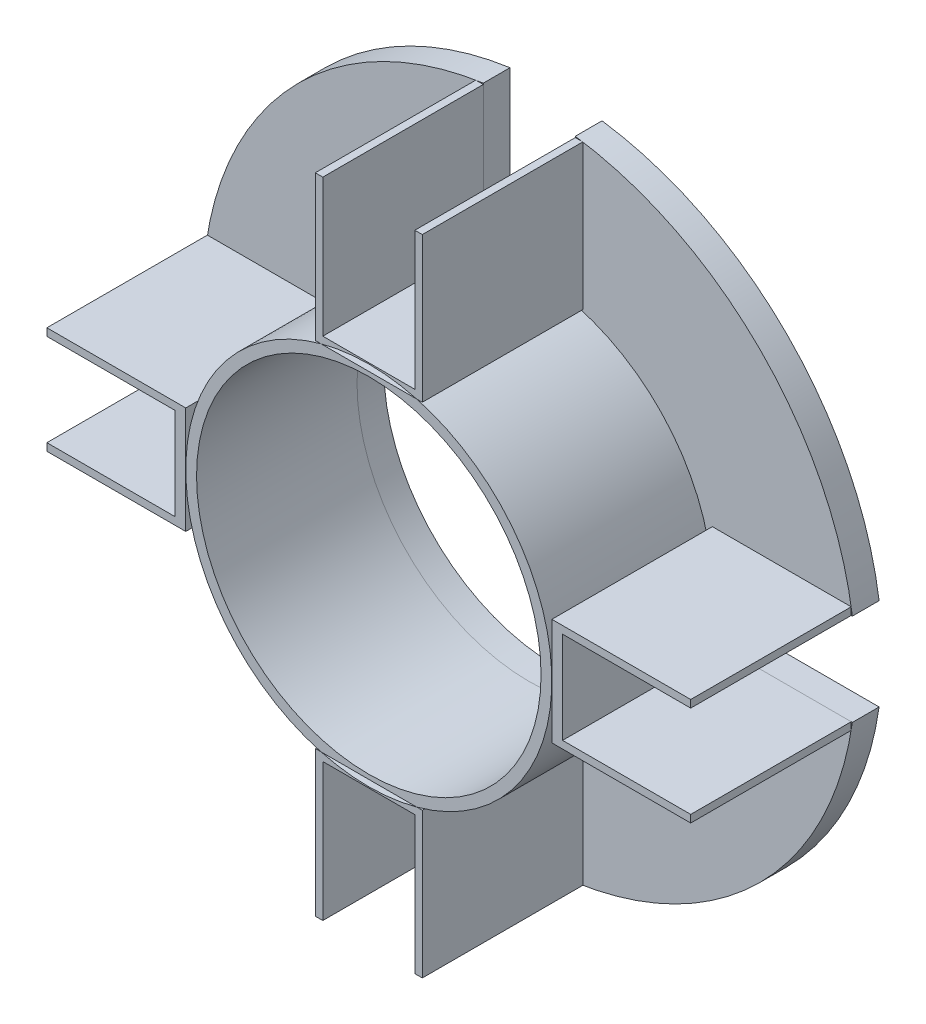
from build123d import *

# Parameters (mm, degrees)
SKETCH1_R             = 16.1
BOSS_EXTRUDE1_DEPTH   = 15
BOSS_EXTRUDE1_2_DEPTH = 15
BOSS_EXTRUDE1_3_DEPTH = 15
BOSS_EXTRUDE1_4_DEPTH = 15
BOSS_EXTRUDE1_5_DEPTH = 15
SKETCH2_R             = 30.5
BOSS_EXTRUDE8_DEPTH   = 2.5
CUT_EXTRUDE1_START    = -1
SKETCH3_W             = 15
SKETCH3_H             = 8.6
CUT_EXTRUDE1_DEPTH    = 1.853819388
CUT_EXTRUDE2_START    = -1
SKETCH4_W             = 17.5
SKETCH4_H             = 8.6
CUT_EXTRUDE2_DEPTH    = 1.853819388
CUT_EXTRUDE3_START    = -2.5
SKETCH5_R             = 16.1
SKETCH5_W             = 18.491872575
SKETCH5_H             = 8.6
SKETCH5_W_2           = 8.6
SKETCH5_H_2           = 42.348370594
SKETCH5_W_3           = 37.801288888
SKETCH5_H_3           = 29.036785998
CUT_EXTRUDE3_DEPTH    = 2.5


with BuildPart() as part:
    # Sketch1 → Boss-Extrude1 (new body)
    with BuildSketch(Plane.XY):
        with BuildLine():
            ThreePointArc((4.476636951, -16.512627233), (13.588533998, -10.39513734), (17.108685997, 0))
            ThreePointArc((17.108685997, 0), (13.588533998, 10.39513734), (4.476636951, 16.512627233))
            Line((4.476636951, 16.512627233), (-4.476636951, 16.512627233))
            ThreePointArc((-4.476636951, 16.512627233), (-13.588533998, 10.39513734), (-17.108685997, 0))
            ThreePointArc((-17.108685997, 0), (-13.588533998, -10.39513734), (-4.476636951, -16.512627233))
            Line((-4.476636951, -16.512627233), (4.476636951, -16.512627233))
        make_face()
        Circle(SKETCH1_R, mode=Mode.SUBTRACT)
    extrude(amount=BOSS_EXTRUDE1_DEPTH)


with BuildPart() as body_2:
    # Sketch1 → Boss-Extrude1 2 (new body)
    with BuildSketch(Plane.XY):
        Polygon((17.108685997, 5), (17.108685997, 0), (17.108685997, -5), (30.087372767, -5), (30.087372767, -4.3), (19.962505385, -4.3), (19.962505385, 4.3), (30.087372767, 4.3), (30.087372767, 5), align=None)
    extrude(amount=BOSS_EXTRUDE1_2_DEPTH)

    # Sketch3 → Cut-Extrude1 (cut)
    with BuildSketch(Plane.ZY.offset(-17.108685997).offset(CUT_EXTRUDE1_START)):
        with Locations((7.5, 0)):
            Rectangle(SKETCH3_W, SKETCH3_H)
    extrude(amount=-CUT_EXTRUDE1_DEPTH, mode=Mode.SUBTRACT)


with BuildPart() as body_3:
    # Sketch1 → Boss-Extrude1 3 (new body)
    with BuildSketch(Plane.XY):
        Polygon((-17.108685997, -5), (-17.108685997, 0), (-17.108685997, 5), (-30.087372767, 5), (-30.087372767, 4.3), (-19.962505385, 4.3), (-19.962505385, -4.3), (-30.087372767, -4.3), (-30.087372767, -5), align=None)
    extrude(amount=BOSS_EXTRUDE1_3_DEPTH)

    # Sketch4 → Cut-Extrude2 (cut)
    with BuildSketch(Plane(origin=(-17.108685997, 0, 0), x_dir=(0, 0, -1), z_dir=(1, 0, 0)).offset(CUT_EXTRUDE2_START)):
        with Locations((-6.25, 0)):
            Rectangle(SKETCH4_W, SKETCH4_H)
    extrude(amount=-CUT_EXTRUDE2_DEPTH, mode=Mode.SUBTRACT)


with BuildPart() as body_4:
    # Sketch1 → Boss-Extrude1 4 (new body)
    with BuildSketch(Plane.XY):
        with BuildLine():
            Line((4.476636951, 16.512627233), (5, 16.512627233))
            Line((5, 16.512627233), (5, 30.087372767))
            Line((5, 30.087372767), (4.3, 30.087372767))
            Line((4.3, 30.087372767), (4.3, 17.212627233))
            Line((4.3, 17.212627233), (-4.3, 17.212627233))
            Line((-4.3, 17.212627233), (-4.3, 30.087372767))
            Line((-4.3, 30.087372767), (-5, 30.087372767))
            Line((-5, 30.087372767), (-5, 16.512627233))
            Line((-5, 16.512627233), (-4.476636951, 16.512627233))
            ThreePointArc((-4.476636951, 16.512627233), (0, 17.108685997), (4.476636951, 16.512627233))
        make_face()
    extrude(amount=BOSS_EXTRUDE1_4_DEPTH)


with BuildPart() as body_5:
    # Sketch1 → Boss-Extrude1 5 (new body)
    with BuildSketch(Plane.XY):
        with BuildLine():
            Line((5, -16.512627233), (4.476636951, -16.512627233))
            ThreePointArc((4.476636951, -16.512627233), (0, -17.108685997), (-4.476636951, -16.512627233))
            Line((-4.476636951, -16.512627233), (-5, -16.512627233))
            Line((-5, -16.512627233), (-5, -30.087372767))
            Line((-5, -30.087372767), (-4.3, -30.087372767))
            Line((-4.3, -30.087372767), (-4.3, -17.212627233))
            Line((-4.3, -17.212627233), (4.3, -17.212627233))
            Line((4.3, -17.212627233), (4.3, -30.087372767))
            Line((4.3, -30.087372767), (5, -30.087372767))
            Line((5, -30.087372767), (5, -16.512627233))
        make_face()
    extrude(amount=BOSS_EXTRUDE1_5_DEPTH)


with BuildPart() as body_6:
    # Sketch2 → Boss-Extrude8 (new body)
    with BuildSketch(Plane(origin=(0, 0, 0), x_dir=(-1, 0, 0), z_dir=(0, 0, -1))):
        Circle(SKETCH2_R)
    extrude(amount=BOSS_EXTRUDE8_DEPTH)

    # Sketch5 → Cut-Extrude3 (cut)
    with BuildSketch(Plane.XY.offset(CUT_EXTRUDE3_START)):
        Circle(SKETCH5_R)
        with Locations((-27.354622285, 0)):
            Rectangle(SKETCH5_W, SKETCH5_H)
        with Locations((0, 38.38681253)):
            Rectangle(SKETCH5_W_2, SKETCH5_H_2)
        with Locations((37.009330441, 0)):
            Rectangle(SKETCH5_W_3, SKETCH5_H)
        with Locations((0, -31.731020232)):
            Rectangle(SKETCH5_W_2, SKETCH5_H_3)
    extrude(amount=CUT_EXTRUDE3_DEPTH, mode=Mode.SUBTRACT)


solid = Compound([part.part, body_2.part, body_3.part, body_4.part, body_5.part, body_6.part])
